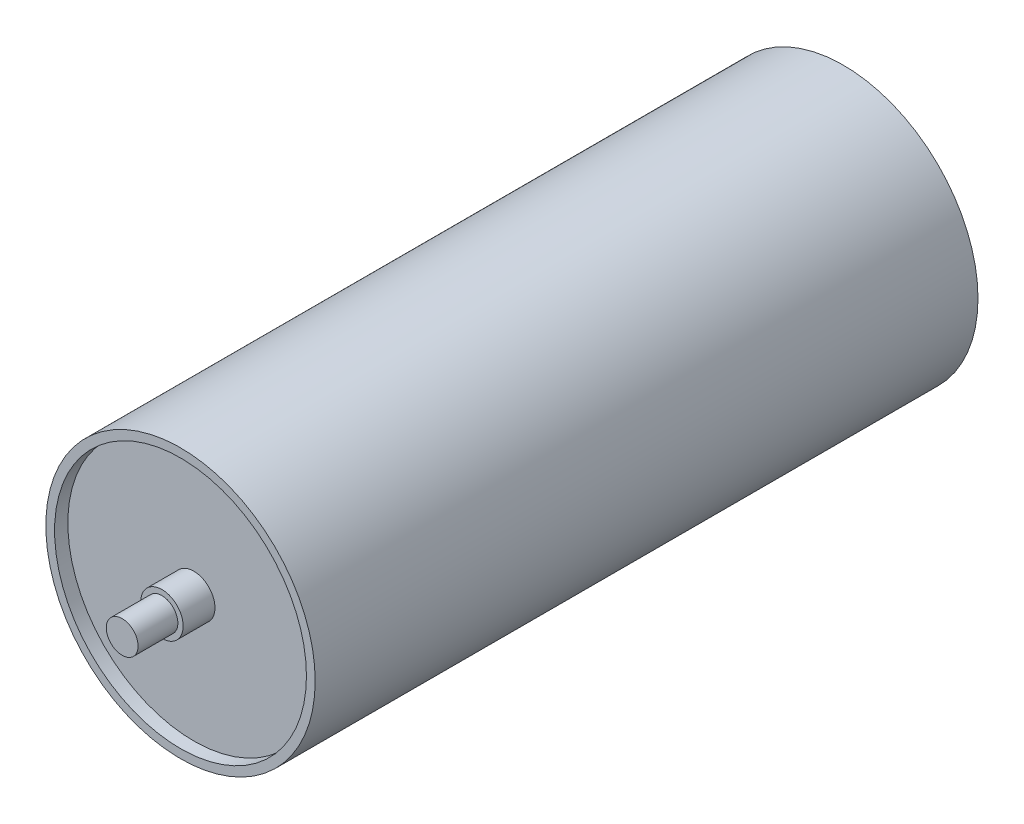
from build123d import *

# Parameters (mm, degrees)
SKETCH1_R           = 50.8
BOSS_EXTRUDE1_DEPTH = 250
SKETCH2_R           = 47.5
CUT_EXTRUDE1_DEPTH  = 5
CUT_EXTRUDE2_START  = -5
SKETCH3_R           = 47.5
CUT_EXTRUDE2_DEPTH  = 5
SKETCH4_R           = 8
BOSS_EXTRUDE2_DEPTH = 11
BOSS_EXTRUDE3_START = 12
SKETCH5_R           = 8
BOSS_EXTRUDE3_DEPTH = 12
SKETCH7_R           = 6
BOSS_EXTRUDE4_DEPTH = 10
BOSS_EXTRUDE5_START = 15
SKETCH8_R           = 6
BOSS_EXTRUDE5_DEPTH = 15


with BuildPart() as part:
    # Sketch1 → Boss-Extrude1 (new body)
    with BuildSketch(Plane.XY):
        Circle(SKETCH1_R)
    extrude(amount=BOSS_EXTRUDE1_DEPTH)

    # Sketch2 → Cut-Extrude1 (cut)
    with BuildSketch(Plane.XY.offset(250)):
        Circle(SKETCH2_R)
    extrude(amount=-CUT_EXTRUDE1_DEPTH, mode=Mode.SUBTRACT)

    # Sketch3 → Cut-Extrude2 (cut)
    with BuildSketch(Plane(origin=(0, 0, 0), x_dir=(-1, 0, 0), z_dir=(0, 0, -1)).offset(CUT_EXTRUDE2_START)):
        with Locations(Location((0, 0, 0), (0, 0, 180))):
            Circle(SKETCH3_R)
    extrude(amount=CUT_EXTRUDE2_DEPTH, mode=Mode.SUBTRACT)

    # Sketch4 → Boss-Extrude2 (add)
    with BuildSketch(Plane(origin=(0, 0, 5), x_dir=(-1, 0, 0), z_dir=(0, 0, -1))):
        Circle(SKETCH4_R)
    extrude(amount=BOSS_EXTRUDE2_DEPTH)

    # Sketch5 → Boss-Extrude3 (add)
    with BuildSketch(Plane.XY.offset(245).offset(BOSS_EXTRUDE3_START)):
        with Locations(Location((0, 0, 0), (0, 0, 180))):
            Circle(SKETCH5_R)
    extrude(amount=-BOSS_EXTRUDE3_DEPTH)

    # Sketch7 → Boss-Extrude4 (add)
    with BuildSketch(Plane(origin=(0, 0, -6), x_dir=(-1, 0, 0), z_dir=(0, 0, -1))):
        Circle(SKETCH7_R)
    extrude(amount=BOSS_EXTRUDE4_DEPTH)

    # Sketch8 → Boss-Extrude5 (add)
    with BuildSketch(Plane.XY.offset(257).offset(BOSS_EXTRUDE5_START)):
        with Locations(Location((0, 0, 0), (0, 0, 180))):
            Circle(SKETCH8_R)
    extrude(amount=-BOSS_EXTRUDE5_DEPTH)


solid = part.part
